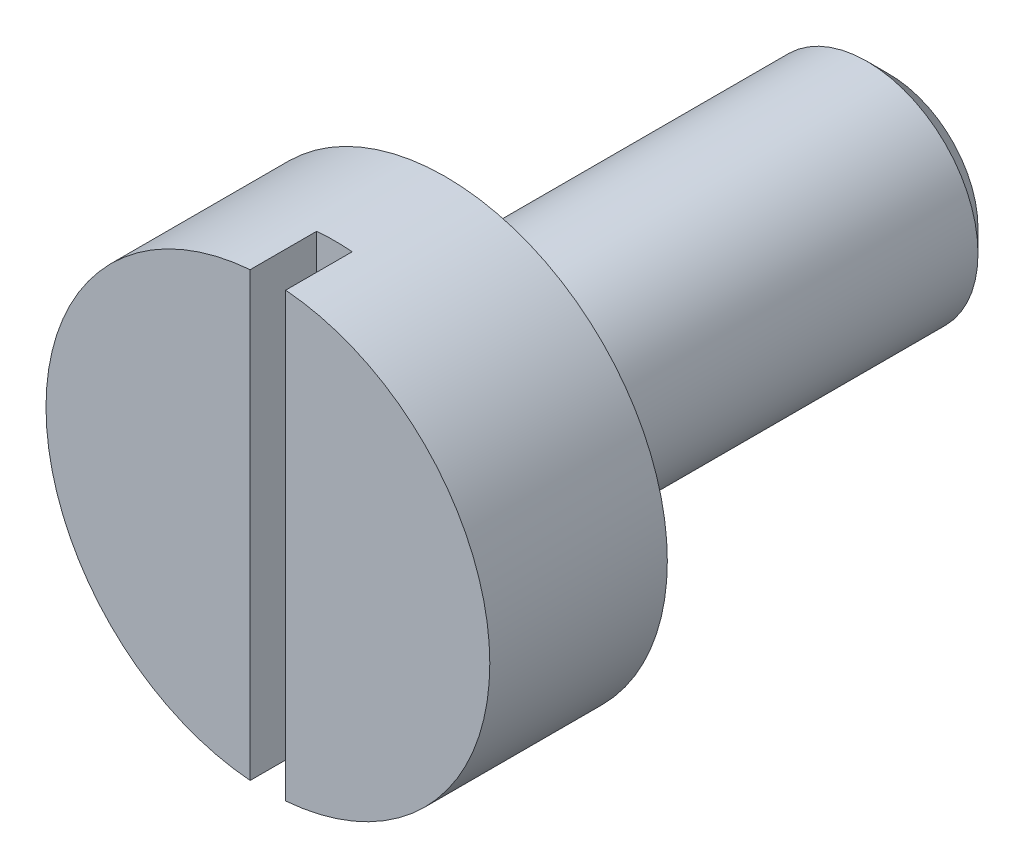
from build123d import *

# Parameters (mm, degrees)
SKETCH_1_R          = 2.5
EXTRUDE_1_DEPTH     = 10
SKETCH_2_R          = 5
EXTRUDE_2_DEPTH     = 4
SKETCH_3_W          = 0.8
SKETCH_3_H          = 11.405632212
CUT_EXTRUDE_1_DEPTH = 1.5
CHAMFER_1_SIZE      = 0.5


with BuildPart() as part:
    # Эскиз1 → Вытянуть1 (new body)
    with BuildSketch(Plane.XY):
        Circle(SKETCH_1_R)
    extrude(amount=EXTRUDE_1_DEPTH)

    # Эскиз2 → Вытянуть2 (add)
    with BuildSketch(Plane.XY.offset(10)):
        with Locations(Location((0, 0, 0), (0, 0, 94.588565736))):
            Circle(SKETCH_2_R)
    extrude(amount=EXTRUDE_2_DEPTH)

    # Эскиз3 → Вырез-Вытянуть1 (cut)
    with BuildSketch(Plane.XY.offset(14)):
        with Locations((0, 0.088759784)):
            Rectangle(SKETCH_3_W, SKETCH_3_H)
    extrude(amount=-CUT_EXTRUDE_1_DEPTH, mode=Mode.SUBTRACT)

    # Фаска1
    chamfer_1_edges = [part.edges().sort_by_distance(p)[0] for p in [
        (-2.5, 0, 0),
    ]]
    chamfer(chamfer_1_edges, length=CHAMFER_1_SIZE)


solid = part.part
